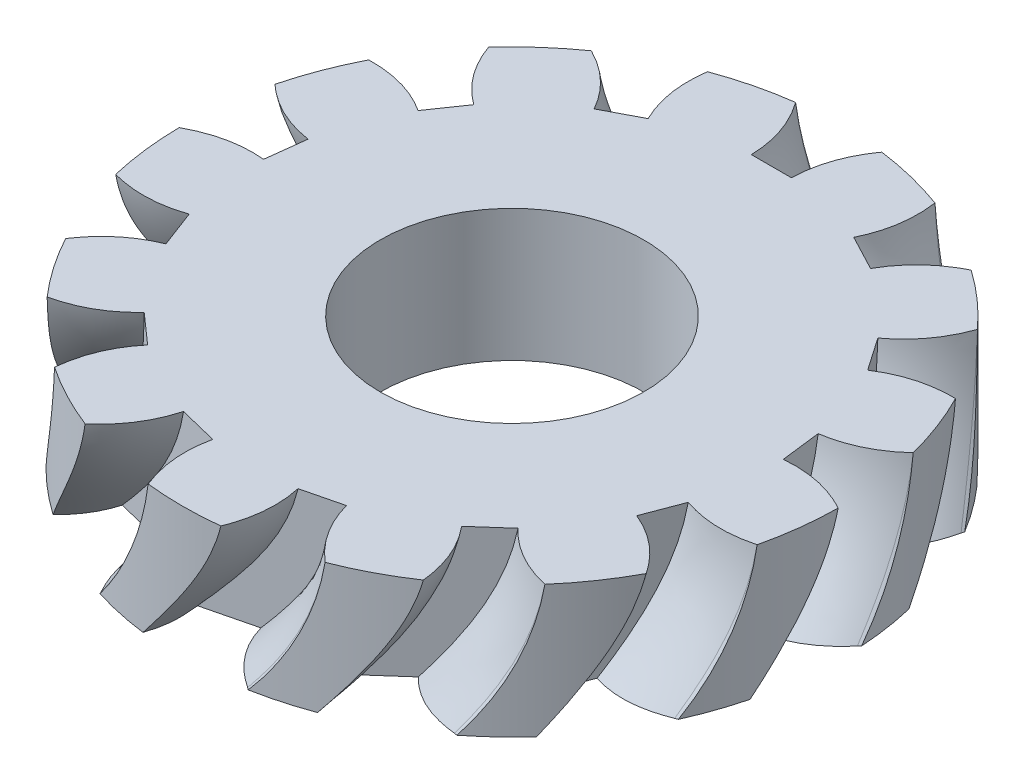
from build123d import *

# Parameters (mm, degrees)
SKETCH_1_R               = 75
SKETCH_1_R_2             = 30
EXTRUDE_1_DEPTH          = 30
PATTERN_CIRCULAR_1_COUNT = 13


with BuildPart() as part:
    # 草图1 → 凸台-拉伸1 (new body)
    with BuildSketch(Plane(origin=(0, 0, 0), x_dir=(1, 0, 0), z_dir=(0, 1, 0))):
        with Locations(Location((0, 0, 0), (0, 0, 270))):
            Circle(SKETCH_1_R)
        with Locations(Location((0, 0, 0), (0, 0, 270))):
            Circle(SKETCH_1_R_2, mode=Mode.SUBTRACT)
    extrude(amount=EXTRUDE_1_DEPTH)

    # 切除-扫描2: sweep along a path in 草图4
    with BuildLine() as sweep_2_path:  # in the path sketch's own coordinates; laid on its plane below (add() does not lay a ready-made edge on the line's plane)
        add(Edge.make_bspline(
            [(0, 30), (2.634865604, 15.736428289), (13.019623801, 4.761598282), (22.49470519, -5.348331634)],
            knots=[0, 0, 0, 0, 1, 1, 1, 1], degree=3))
    # 草图2 → 切除-扫描2 (sweep, cut)
    with BuildSketch(Plane(origin=(0, 30, 0), x_dir=(1, 0, 0), z_dir=(0, 1, 0))):
        with BuildLine():
            Line((-4.548561711, 59.027925843), (4.548561711, 59.027925843))
            add(Edge.make_bspline(
                [(9.802971943, 74.356585055), (4.784194464, 67.405952818), (4.548561711, 59.027925843)],
                knots=[0, 0, 0, 1, 1, 1], degree=2))
            add(Edge.make_bspline(
                [(9.802971943, 74.356585055), (11.636158859, 77.351089207), (14.942384341, 78.540627154)],
                knots=[0, 0, 0, 1, 1, 1], degree=2))
            ThreePointArc((14.942384341, 78.540627154), (0, 79.949390013), (-14.942384341, 78.540627154))
            add(Edge.make_bspline(
                [(-9.802971943, 74.356585055), (-11.636158859, 77.351089207), (-14.942384341, 78.540627154)],
                knots=[0, 0, 0, 1, 1, 1], degree=2))
            add(Edge.make_bspline(
                [(-9.802971943, 74.356585055), (-4.784194464, 67.405952818), (-4.548561711, 59.027925843)],
                knots=[0, 0, 0, 1, 1, 1], degree=2))
        make_face()
    sweep_2 = sweep(path=Plane.XY.offset(-75) * sweep_2_path.line, mode=Mode.SUBTRACT)

    # 阵列(圆周)1: 切除-扫描2 ×13 about axis
    pattern_circular_1_axis = Axis((0, 57.775639109, 0), (0, -1, 0))
    for i in range(1, PATTERN_CIRCULAR_1_COUNT):
        add(sweep_2.rotate(pattern_circular_1_axis, i * 360 / PATTERN_CIRCULAR_1_COUNT), mode=Mode.SUBTRACT)


solid = part.part
